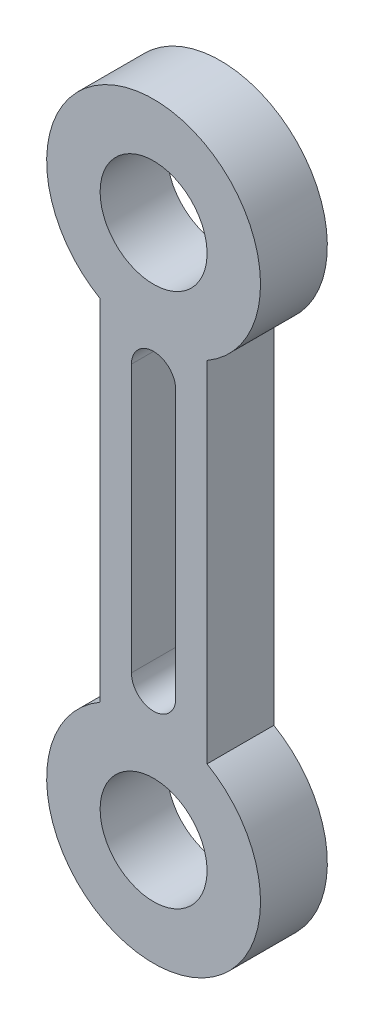
from build123d import *

# Parameters (mm, degrees)
EXTRUDE_1_DEPTH     = 5
SKETCH_3_R          = 4
CUT_EXTRUDE_1_DEPTH = 49.918299235
CUT_EXTRUDE_2_DEPTH = 49.918299235


with BuildPart() as part:
    # 草图1 → 凸台-拉伸1 (new body)
    with BuildSketch(Plane.XY):
        with BuildLine():
            Line((-4, -6.92820323), (-4, 0))
            Line((-4, 0), (4, 0))
            Line((4, 0), (4, -6.92820323))
            ThreePointArc((4, -6.92820323), (6.92820323, -4), (8, 0))
            ThreePointArc((8, 0), (-4, 6.92820323), (-4, -6.92820323))
        make_face()
        with BuildLine():
            Line((4, 0), (-4, 0))
            Line((-4, 0), (-4, -6.92820323))
            ThreePointArc((-4, -6.92820323), (0, -8), (4, -6.92820323))
            Line((4, -6.92820323), (4, 0))
        make_face()
        with BuildLine():
            ThreePointArc((4, -6.92820323), (0, -8), (-4, -6.92820323))
            Line((-4, -6.92820323), (-4, -33.07179677))
            ThreePointArc((-4, -33.07179677), (0, -32), (4, -33.07179677))
            Line((4, -33.07179677), (4, -6.92820323))
        make_face()
        with BuildLine():
            ThreePointArc((4, -33.07179677), (0, -32), (-4, -33.07179677))
            Line((-4, -33.07179677), (-4, -40))
            Line((-4, -40), (4, -40))
            Line((4, -40), (4, -33.07179677))
        make_face()
        with BuildLine():
            Line((-4, -40), (-4, -33.07179677))
            ThreePointArc((-4, -33.07179677), (-4, -46.92820323), (8, -40))
            ThreePointArc((8, -40), (6.92820323, -36), (4, -33.07179677))
            Line((4, -33.07179677), (4, -40))
            Line((4, -40), (-4, -40))
        make_face()
    extrude(amount=EXTRUDE_1_DEPTH)

    # 草图3 → 切除-拉伸1 (cut, through all)
    with BuildSketch(Plane(origin=(0, 0, 0), x_dir=(-1, 0, 0), z_dir=(0, 0, -1))):
        Circle(SKETCH_3_R)
        with Locations((0, -40)):
            Circle(SKETCH_3_R)
    extrude(amount=-CUT_EXTRUDE_1_DEPTH, mode=Mode.SUBTRACT)

    # 草图4 → 切除-拉伸2 (cut, through all)
    with BuildSketch(Plane(origin=(0, 0, 0), x_dir=(-1, 0, 0), z_dir=(0, 0, -1))):
        with BuildLine():
            Line((1.657955328, -10), (1.657955328, -30))
            ThreePointArc((1.657955328, -30), (0, -31.657955328), (-1.657955328, -30))
            Line((-1.657955328, -30), (-1.657955328, -10))
            ThreePointArc((-1.657955328, -10), (0, -8.342044672), (1.657955328, -10))
        make_face()
    extrude(amount=-CUT_EXTRUDE_2_DEPTH, mode=Mode.SUBTRACT)


solid = part.part
